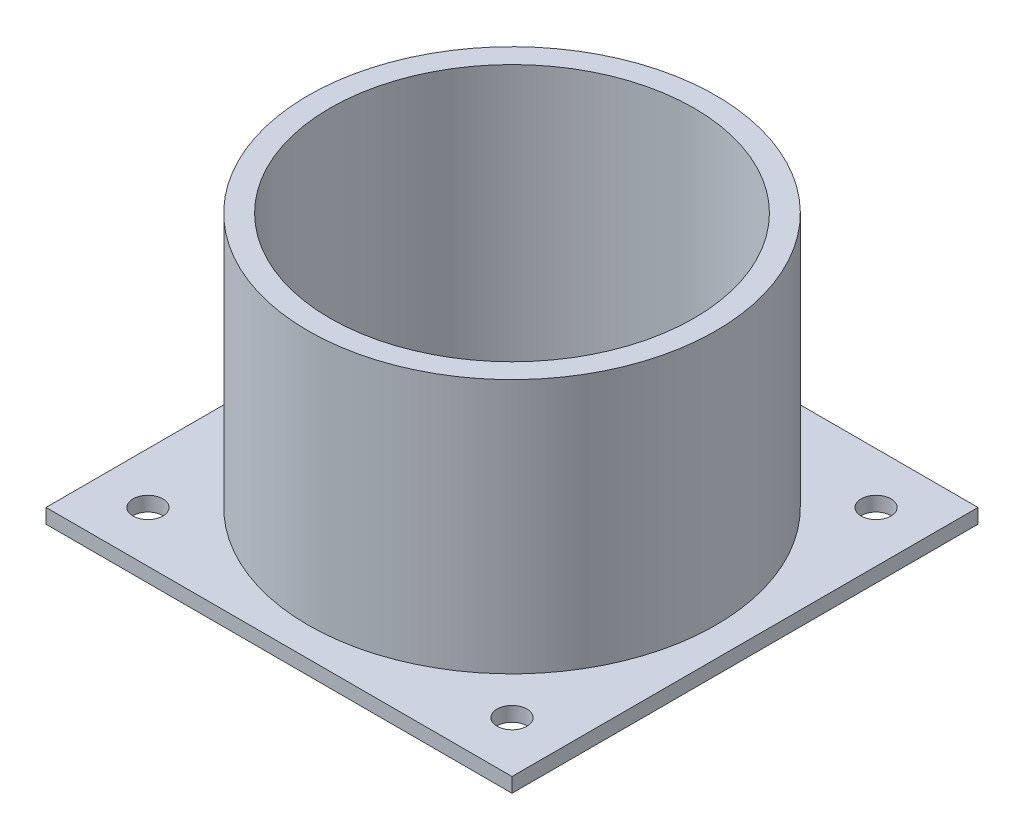
from build123d import *

# Parameters (mm, degrees)
SKETCH_1_W          = 64
SKETCH_1_H          = 64
EXTRUDE_1_DEPTH     = 2
SKETCH_2_R          = 2.05
SKETCH_2_R_2        = 25
CUT_EXTRUDE_1_DEPTH = 2
EXTRUDE_START       = 35
SKETCH_3_R          = 28
SKETCH_3_R_2        = 25
EXTRUDE_2_DEPTH     = 35


with BuildPart() as part:
    # 草图1 → 凸台-拉伸1 (new body)
    with BuildSketch(Plane(origin=(0, 0, 0), x_dir=(1, 0, 0), z_dir=(0, 1, 0))):
        with Locations((8.075949367, -13.283905967)):
            Rectangle(SKETCH_1_W, SKETCH_1_H)
    extrude(amount=EXTRUDE_1_DEPTH)

    # 草图2 → 切除-拉伸1 (cut)
    with BuildSketch(Plane(origin=(0, 2, 0), x_dir=(1, 0, 0), z_dir=(0, 1, 0))):
        with Locations(Location((-16.924050633, 11.716094033, 0), (0, 0, 270))):
            Circle(SKETCH_2_R)
        with Locations(Location((33.075949367, 11.716094033, 0), (0, 0, 270))):
            Circle(SKETCH_2_R)
        with Locations(Location((-16.924050633, -38.283905967, 0), (0, 0, 270))):
            Circle(SKETCH_2_R)
        with Locations(Location((33.075949367, -38.283905967, 0), (0, 0, 270))):
            Circle(SKETCH_2_R)
        with Locations(Location((8.075949367, -13.283905967, 0), (0, 0, 270))):
            Circle(SKETCH_2_R_2)
    extrude(amount=-CUT_EXTRUDE_1_DEPTH, mode=Mode.SUBTRACT)

    # 草图3 → 凸台-拉伸2 (add)
    with BuildSketch(Plane(origin=(0, 2, 0), x_dir=(1, 0, 0), z_dir=(0, 1, 0)).offset(EXTRUDE_START)):
        with Locations(Location((8.075949367, -13.283905967, 0), (0, 0, 270))):
            Circle(SKETCH_3_R)
        with Locations(Location((8.075949367, -13.283905967, 0), (0, 0, 270))):
            Circle(SKETCH_3_R_2, mode=Mode.SUBTRACT)
    extrude(amount=-EXTRUDE_2_DEPTH)


solid = part.part
